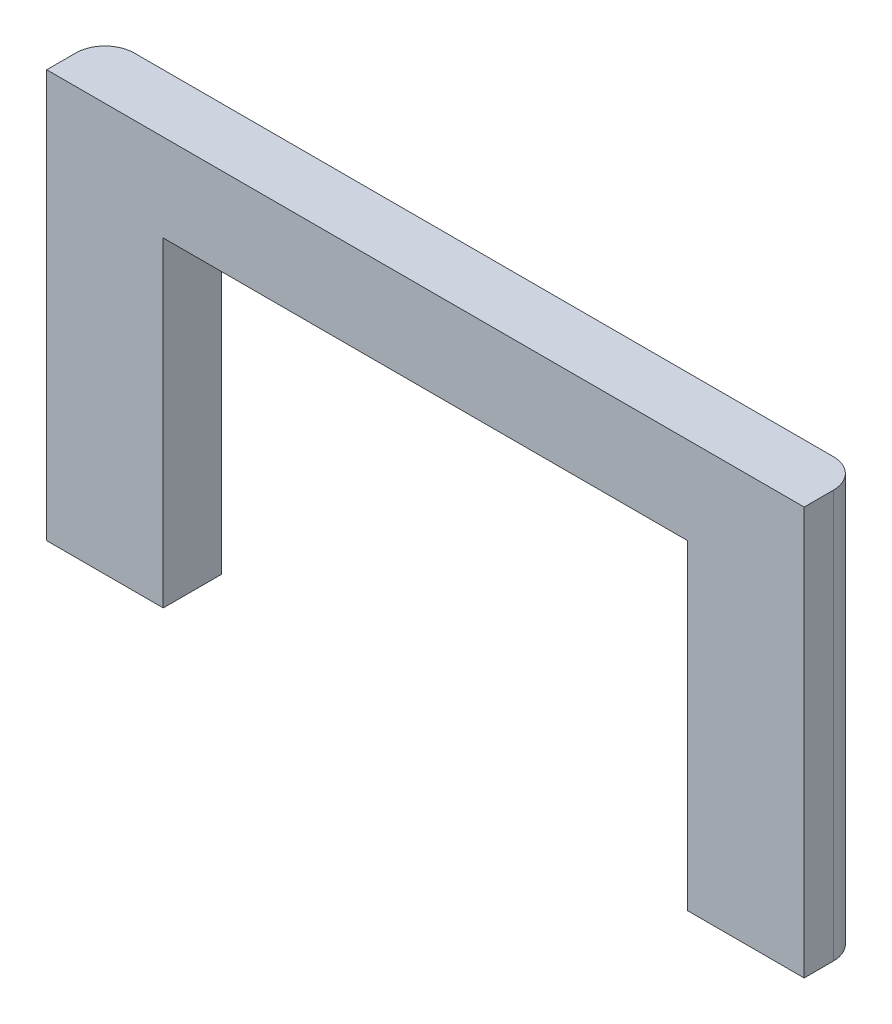
from build123d import *

# Parameters (mm, degrees)
BOSS_EXTRU_1_DEPTH = 10
CONG_2_R           = 5


with BuildPart() as part:
    # Esquisse1 → Boss.-Extru.1 (new body)
    with BuildSketch(Plane.XY):
        Polygon((-83.303964758, 29.911894273), (46.696035242, 29.911894273), (46.696035242, -40.088105727), (26.696035242, -40.088105727), (26.696035242, 14.911894273), (-63.303964758, 14.911894273), (-63.303964758, -40.088105727), (-83.303964758, -40.088105727), align=None)
    extrude(amount=BOSS_EXTRU_1_DEPTH)

    # Congé2
    cong_2_edges = [part.edges().sort_by_distance(p)[0] for p in [
        (-83.303964758, -5.088105727, 0),
        (46.696035242, -5.088105727, 0),
    ]]
    fillet(cong_2_edges, radius=CONG_2_R)


solid = part.part
